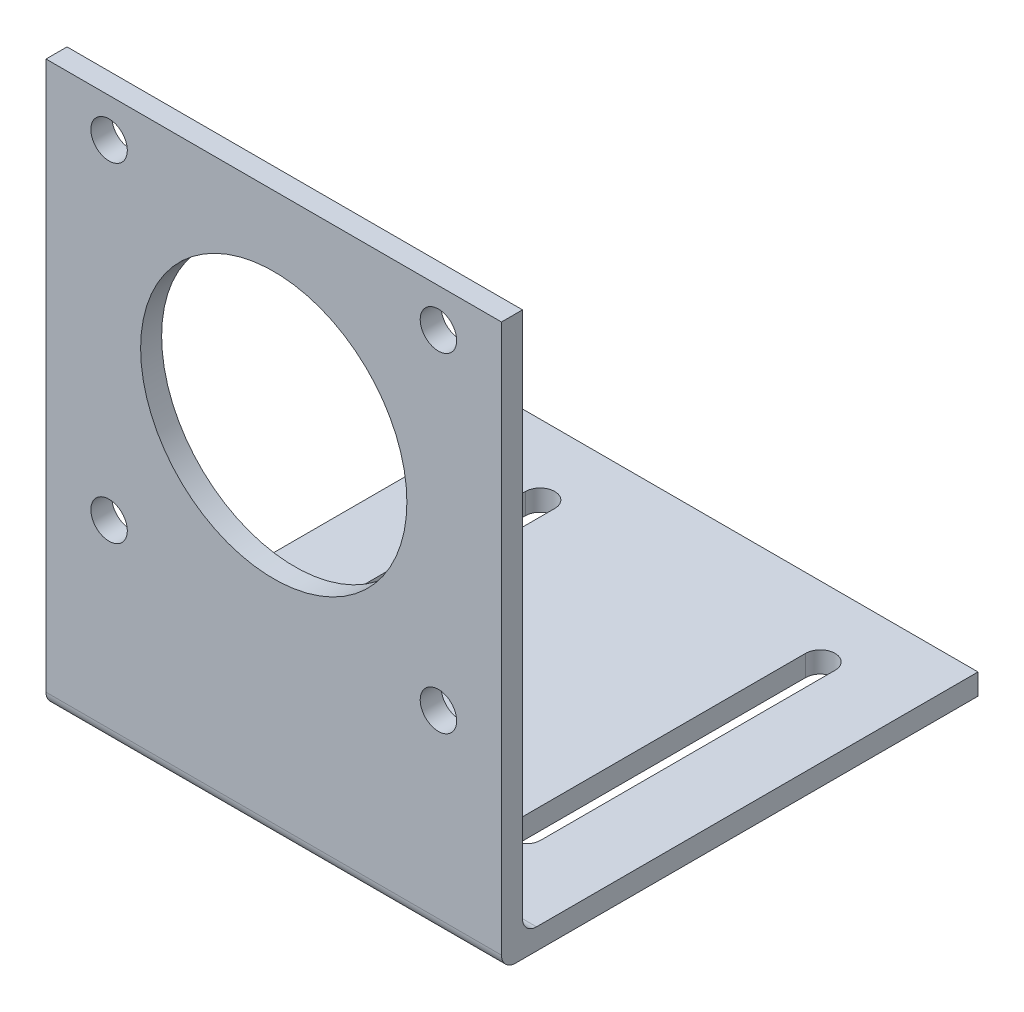
from build123d import *

# Parameters (mm, degrees)
BODY_DEPTH         = 65
CUT_EXTRUDE1_DEPTH = 3
SKETCH5_R          = 19
SKETCH5_R_2        = 2.6
CUT_EXTRUDE2_DEPTH = 3


with BuildPart() as part:
    # Sketch1 → Body (new body)
    with BuildSketch(Plane(origin=(0, 0, 0), x_dir=(0, 0, -1), z_dir=(1, 0, 0))):
        with BuildLine():
            Line((0, 0), (-66, 0))
            ThreePointArc((-66, 0), (-67.414213562, 0.585786438), (-68, 2))
            Line((-68, 2), (-68, 80.25))
            Line((-68, 80.25), (-65, 80.25))
            Line((-65, 80.25), (-65, 5))
            ThreePointArc((-65, 5), (-64.414213562, 3.585786438), (-63, 3))
            Line((-63, 3), (0, 3))
            Line((0, 3), (0, 0))
        make_face()
    extrude(amount=BODY_DEPTH)

    # Sketch4 → Cut-Extrude1 (cut)
    with BuildSketch(Plane(origin=(0, 3, 0), x_dir=(1, 0, 0), z_dir=(0, 1, 0))):
        with BuildLine():
            Line((50.4, -52), (50.4, -10))
            ThreePointArc((50.4, -10), (52.5, -7.9), (54.6, -10))
            Line((54.6, -10), (54.6, -52))
            ThreePointArc((54.6, -52), (52.5, -54.1), (50.4, -52))
        make_face()
        with BuildLine():
            Line((10.4, -52), (10.4, -10))
            ThreePointArc((10.4, -10), (12.5, -7.9), (14.6, -10))
            Line((14.6, -10), (14.6, -52))
            ThreePointArc((14.6, -52), (12.5, -54.1), (10.4, -52))
        make_face()
    extrude(amount=-CUT_EXTRUDE1_DEPTH, mode=Mode.SUBTRACT)

    # Sketch5 → Cut-Extrude2 (cut)
    with BuildSketch(Plane(origin=(0, 0, 65), x_dir=(-1, 0, 0), z_dir=(0, 0, -1))):
        with Locations((-32.5, 51.25)):
            Circle(SKETCH5_R)
        with Locations((-9, 74.75)):
            Circle(SKETCH5_R_2)
        with Locations((-56, 74.75)):
            Circle(SKETCH5_R_2)
        with Locations((-56, 27.75)):
            Circle(SKETCH5_R_2)
        with Locations((-9, 27.75)):
            Circle(SKETCH5_R_2)
    extrude(amount=-CUT_EXTRUDE2_DEPTH, mode=Mode.SUBTRACT)


solid = part.part
